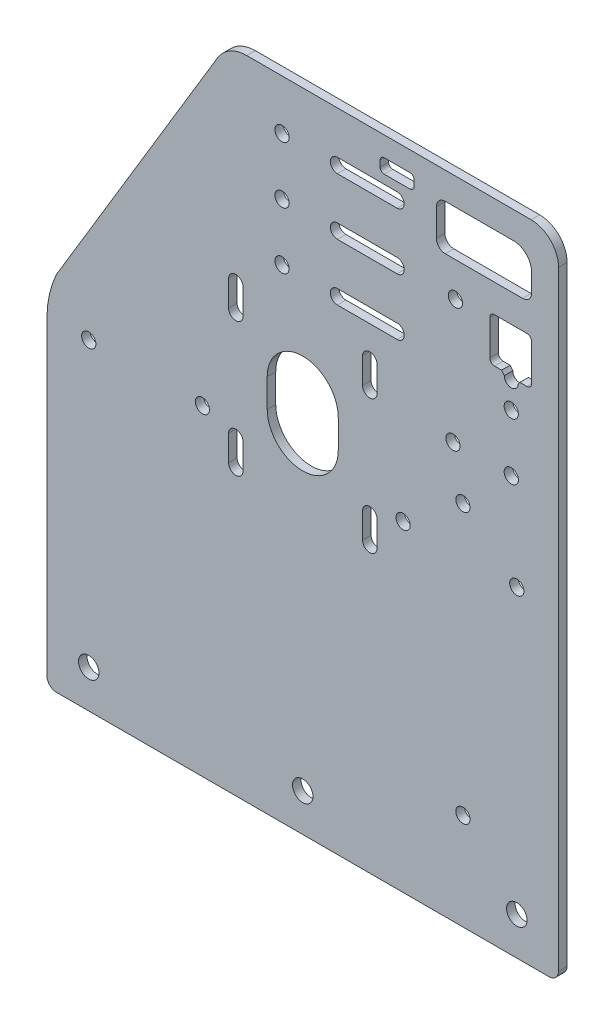
from build123d import *

# Parameters (mm, degrees)
MODEL_R             = 3.6
MODEL_R_2           = 2.5
BOSS_EXTRUDE1_DEPTH = 3


with BuildPart() as part:
    # Model → Boss-Extrude1 (new body)
    with BuildSketch(Plane.XY):
        with BuildLine():
            Line((-86.64, 0), (86.64, 0))
            ThreePointArc((86.64, 0), (89.015878785, 0.984121215), (90, 3.36))
            Line((90, 3.36), (90, 217.83))
            ThreePointArc((90, 217.83), (87.167722574, 224.667722574), (80.33, 227.5))
            Line((80.33, 227.5), (-19.67, 227.5))
            ThreePointArc((-19.67, 227.5), (-25.584006957, 225.942971908), (-29.964579281, 221.67560728))
            Line((-29.964579281, 221.67560728), (-86.618767522, 127.387204203))
            ThreePointArc((-86.618767522, 127.387204203), (-89.126906327, 120.031940724), (-90, 112.31))
            Line((-90, 112.31), (-90, 3.36))
            ThreePointArc((-90, 3.36), (-89.015878785, 0.984121215), (-86.64, 0))
        make_face()
        with Locations((-75.285, 13.33)):
            Circle(MODEL_R, mode=Mode.SUBTRACT)
        with Locations((-7.295, 209.94)):
            Circle(MODEL_R_2, mode=Mode.SUBTRACT)
        with Locations((-7.295, 189.94)):
            Circle(MODEL_R_2, mode=Mode.SUBTRACT)
        with Locations((-7.295, 169.94)):
            Circle(MODEL_R_2, mode=Mode.SUBTRACT)
        with Locations((-35.285, 113.03)):
            Circle(MODEL_R_2, mode=Mode.SUBTRACT)
        with Locations((-75.285, 113.03)):
            Circle(MODEL_R_2, mode=Mode.SUBTRACT)
        with Locations((75.315, 13.33)):
            Circle(MODEL_R, mode=Mode.SUBTRACT)
        with Locations((0, 13.33)):
            Circle(MODEL_R, mode=Mode.SUBTRACT)
        with Locations((56.355, 34.03)):
            Circle(MODEL_R_2, mode=Mode.SUBTRACT)
        with Locations((53.705, 189.94)):
            Circle(MODEL_R_2, mode=Mode.SUBTRACT)
        with Locations((73.365, 165.98)):
            Circle(MODEL_R_2, mode=Mode.SUBTRACT)
        with Locations((73.365, 145.98)):
            Circle(MODEL_R_2, mode=Mode.SUBTRACT)
        with Locations((52.865, 145.98)):
            Circle(MODEL_R_2, mode=Mode.SUBTRACT)
        with Locations((56.355, 129.03)):
            Circle(MODEL_R_2, mode=Mode.SUBTRACT)
        with Locations((75.315, 113.03)):
            Circle(MODEL_R_2, mode=Mode.SUBTRACT)
        with Locations((35.315, 113.03)):
            Circle(MODEL_R_2, mode=Mode.SUBTRACT)
        with BuildLine():
            Line((-26.095, 100.21), (-26.095, 109.21))
            ThreePointArc((-26.095, 109.21), (-23.555, 111.75), (-21.015, 109.21))
            Line((-21.015, 109.21), (-21.015, 100.21))
            ThreePointArc((-21.015, 100.21), (-23.555, 97.67), (-26.095, 100.21))
        make_face(mode=Mode.SUBTRACT)
        with BuildLine():
            Line((-26.095, 147.35), (-26.095, 156.35))
            ThreePointArc((-26.095, 156.35), (-23.555, 158.89), (-21.015, 156.35))
            Line((-21.015, 156.35), (-21.015, 147.35))
            ThreePointArc((-21.015, 147.35), (-23.555, 144.81), (-26.095, 147.35))
        make_face(mode=Mode.SUBTRACT)
        with BuildLine():
            Line((21.045, 100.21), (21.045, 109.21))
            ThreePointArc((21.045, 109.21), (23.585, 111.75), (26.125, 109.21))
            Line((26.125, 109.21), (26.125, 100.21))
            ThreePointArc((26.125, 100.21), (23.585, 97.67), (21.045, 100.21))
        make_face(mode=Mode.SUBTRACT)
        with BuildLine():
            Line((21.045, 147.35), (21.045, 156.35))
            ThreePointArc((21.045, 156.35), (23.585, 158.89), (26.125, 156.35))
            Line((26.125, 156.35), (26.125, 147.35))
            ThreePointArc((26.125, 147.35), (23.585, 144.81), (21.045, 147.35))
        make_face(mode=Mode.SUBTRACT)
        with BuildLine():
            Line((27.205, 216.97), (27.205, 219.09))
            ThreePointArc((27.205, 219.09), (27.626766235, 220.108233765), (28.645, 220.53))
            Line((28.645, 220.53), (37.765, 220.53))
            ThreePointArc((37.765, 220.53), (38.783233765, 220.108233765), (39.205, 219.09))
            Line((39.205, 219.09), (39.205, 216.97))
            ThreePointArc((39.205, 216.97), (38.783233765, 215.951766235), (37.765, 215.53))
            Line((37.765, 215.53), (28.645, 215.53))
            ThreePointArc((28.645, 215.53), (27.626766235, 215.951766235), (27.205, 216.97))
        make_face(mode=Mode.SUBTRACT)
        with BuildLine():
            Line((76.385, 175.96), (75.817986625, 175.249714613))
            add(Edge.make_bspline(
                [(70.912013375, 175.249714613), (70.912013401, 172.796728014), (73.365, 172.796728014), (75.817986599, 172.796728014), (75.817986625, 175.249714613)],
                knots=[3.141592664, 3.141592664, 3.141592664, 4.71238898, 4.71238898, 6.283185297, 6.283185297, 6.283185297], degree=2, weights=[1, 0.707106785, 1, 0.707106785, 1]))
            Line((70.912013375, 175.249714613), (69.945, 176.461071346))
            Line((69.945, 176.461071346), (67.475, 176.461071346))
            ThreePointArc((67.475, 176.461071346), (66.301202743, 176.947274089), (65.815, 178.121071346))
            Line((65.815, 178.121071346), (65.815, 190.45))
            ThreePointArc((65.815, 190.45), (66.301202743, 191.623797257), (67.475, 192.11))
            Line((67.475, 192.11), (78.855, 192.11))
            ThreePointArc((78.855, 192.11), (80.028797257, 191.623797257), (80.515, 190.45))
            Line((80.515, 190.45), (80.515, 177.62))
            ThreePointArc((80.515, 177.62), (80.028797257, 176.446202743), (78.855, 175.96))
            Line((78.855, 175.96), (76.385, 175.96))
        make_face(mode=Mode.SUBTRACT)
        with BuildLine():
            Line((47.015, 205.17), (47.015, 214.86))
            ThreePointArc((47.015, 214.86), (47.934684707, 217.080315293), (50.155, 218))
            Line((50.155, 218), (74.165, 218))
            ThreePointArc((74.165, 218), (78.655128061, 216.140128061), (80.515, 211.65))
            Line((80.515, 211.65), (80.515, 205.17))
            ThreePointArc((80.515, 205.17), (79.595315293, 202.949684707), (77.375, 202.03))
            Line((77.375, 202.03), (50.155, 202.03))
            ThreePointArc((50.155, 202.03), (47.934684707, 202.949684707), (47.015, 205.17))
        make_face(mode=Mode.SUBTRACT)
        with BuildLine():
            Line((33.205, 167.44), (12.205, 167.44))
            ThreePointArc((12.205, 167.44), (9.705, 169.94), (12.205, 172.44))
            Line((12.205, 172.44), (33.205, 172.44))
            ThreePointArc((33.205, 172.44), (35.705, 169.94), (33.205, 167.44))
        make_face(mode=Mode.SUBTRACT)
        with BuildLine():
            Line((33.205, 187.44), (12.205, 187.44))
            ThreePointArc((12.205, 187.44), (9.705, 189.94), (12.205, 192.44))
            Line((12.205, 192.44), (33.205, 192.44))
            ThreePointArc((33.205, 192.44), (35.705, 189.94), (33.205, 187.44))
        make_face(mode=Mode.SUBTRACT)
        with BuildLine():
            Line((33.205, 207.44), (12.205, 207.44))
            ThreePointArc((12.205, 207.44), (9.705, 209.94), (12.205, 212.44))
            Line((12.205, 212.44), (33.205, 212.44))
            ThreePointArc((33.205, 212.44), (35.705, 209.94), (33.205, 207.44))
        make_face(mode=Mode.SUBTRACT)
        with BuildLine():
            Line((-12.5, 123.28), (-12.5, 133.28))
            ThreePointArc((-12.5, 133.28), (0, 145.78), (12.5, 133.28))
            Line((12.5, 133.28), (12.5, 123.28))
            ThreePointArc((12.5, 123.28), (0, 110.78), (-12.5, 123.28))
        make_face(mode=Mode.SUBTRACT)
    extrude(amount=BOSS_EXTRUDE1_DEPTH)


solid = part.part
